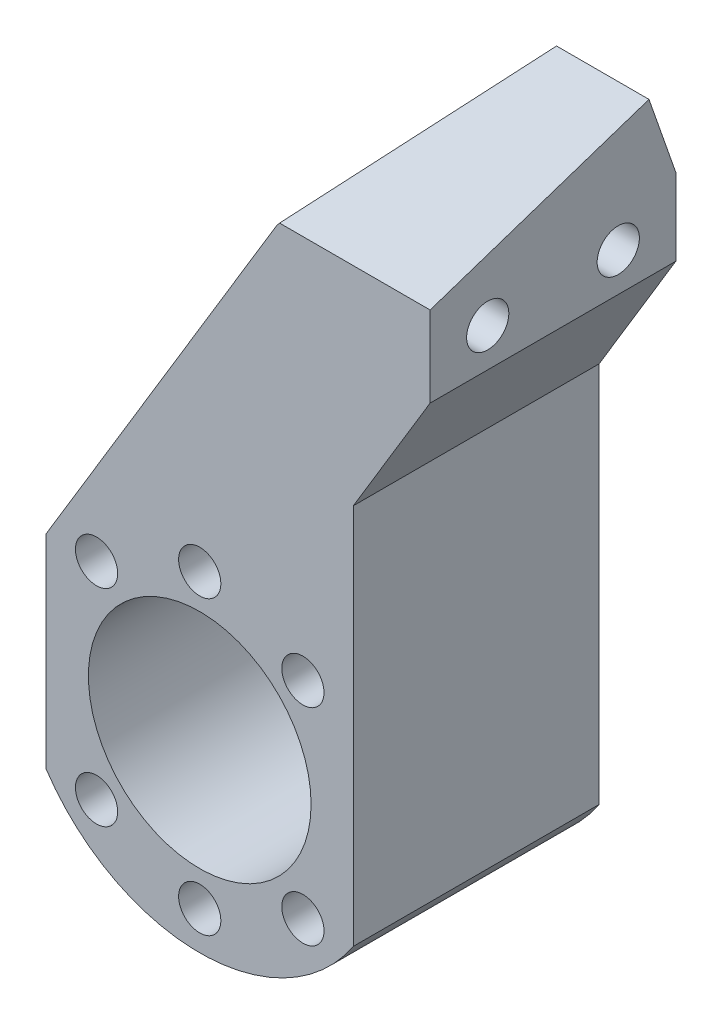
from build123d import *

# Parameters (mm, degrees)
ESQUISSE2_R             = 2.75
ESQUISSE2_R_2           = 14.5
BOSS_EXTRU_1_DEPTH      = 32
BOSS_EXTRU_4_DEPTH      = 32
ENL_V_MAT_EXTRU_3_REACH = 88.563
ESQUISSE10_R            = 2.75
BOSS_EXTRU_6_DEPTH      = 20
ENL_V_MAT_EXTRU_4_REACH = 87.165
ENL_V_MAT_EXTRU_5_REACH = 91.18
ESQUISSE13_R            = 6


with BuildPart() as part:
    # Esquisse2 → Boss.-Extru.1 (new body)
    with BuildSketch(Plane.XY):
        with BuildLine():
            Line((20, 13.266499161), (20, -13.266499161))
            ThreePointArc((20, -13.266499161), (0, -24), (-20, -13.266499161))
            Line((-20, -13.266499161), (-20, 13.266499161))
            ThreePointArc((-20, 13.266499161), (0, 24), (20, 13.266499161))
        make_face()
        with Locations((0, 19)):
            Circle(ESQUISSE2_R, mode=Mode.SUBTRACT)
        with Locations((-13.435028843, 13.435028843)):
            Circle(ESQUISSE2_R, mode=Mode.SUBTRACT)
        with Locations((13.435028843, 13.435028843)):
            Circle(ESQUISSE2_R, mode=Mode.SUBTRACT)
        with Locations((0, -19)):
            Circle(ESQUISSE2_R, mode=Mode.SUBTRACT)
        with Locations((13.435028843, -13.435028843)):
            Circle(ESQUISSE2_R, mode=Mode.SUBTRACT)
        with Locations((-13.435028843, -13.435028843)):
            Circle(ESQUISSE2_R, mode=Mode.SUBTRACT)
        Circle(ESQUISSE2_R_2, mode=Mode.SUBTRACT)
    extrude(amount=BOSS_EXTRU_1_DEPTH)

    # Esquisse7 → Boss.-Extru.4 (add)
    with BuildSketch(Plane(origin=(0, 0, 0), x_dir=(-1, 0, 0), z_dir=(0, 0, -1))):
        with BuildLine():
            Line((-10, 63.000996071), (20, 13.266499161))
            ThreePointArc((20, 13.266499161), (0, 24), (-20, 13.266499161))
            Line((-20, 13.266499161), (-20, 36.422830435))
            Line((-20, 36.422830435), (-30, 53.000996071))
            Line((-30, 53.000996071), (-30, 63.000996071))
            Line((-30, 63.000996071), (-10, 63.000996071))
        make_face()
    extrude(amount=-BOSS_EXTRU_4_DEPTH)

    # Enlèv. mat.-Extru.3: up to this plane
    enl_v_mat_extru_3_end = Plane(origin=(10, 63.000996071, 102.523188973), z_dir=(-0.8562805371039014, 0.5165110277400223, 0))
    # Esquisse10 → Enlèv. mat.-Extru.3 (cut, up to the surface)
    with BuildSketch(Plane(origin=(30, 0, 0), x_dir=(0, 0, -1), z_dir=(1, 0, 0)), mode=Mode.PRIVATE) as enl_v_mat_extru_3_sk1:
        with Locations((-24.5, 58.000996071)):
            Circle(ESQUISSE10_R)
    enl_v_mat_extru_3_tool1 = split(extrude(enl_v_mat_extru_3_sk1.sketch, amount=-ENL_V_MAT_EXTRU_3_REACH, mode=Mode.PRIVATE), bisect_by=enl_v_mat_extru_3_end, keep=Keep.BOTH, mode=Mode.PRIVATE)
    add(enl_v_mat_extru_3_tool1.solids().sort_by_distance((30, 58.000996, 24.5))[0], mode=Mode.SUBTRACT)
    # Esquisse10 → Enlèv. mat.-Extru.3 (cut, up to the surface)
    with BuildSketch(Plane(origin=(30, 0, 0), x_dir=(0, 0, -1), z_dir=(1, 0, 0)), mode=Mode.PRIVATE) as enl_v_mat_extru_3_sk2:
        with Locations((-7.5, 58.000996071)):
            Circle(ESQUISSE10_R)
    enl_v_mat_extru_3_tool2 = split(extrude(enl_v_mat_extru_3_sk2.sketch, amount=-ENL_V_MAT_EXTRU_3_REACH, mode=Mode.PRIVATE), bisect_by=enl_v_mat_extru_3_end, keep=Keep.BOTH, mode=Mode.PRIVATE)
    add(enl_v_mat_extru_3_tool2.solids().sort_by_distance((30, 58.000996, 7.5))[0], mode=Mode.SUBTRACT)

    # Esquisse11 → Boss.-Extru.6 (add)
    with BuildSketch(Plane(origin=(30, 0, 0), x_dir=(0, 0, -1), z_dir=(1, 0, 0))):
        Polygon((-32, 63.000996071), (0, 63.000996071), (-3.5, 73.000996071), (-32, 63.500996071), align=None)
    extrude(amount=-BOSS_EXTRU_6_DEPTH)

    # Esquisse12 → Enlèv. mat.-Extru.4 (cut, up to next)
    with BuildSketch(Plane(origin=(0, 0, 0), x_dir=(-1, 0, 0), z_dir=(0, 0, -1)), mode=Mode.PRIVATE) as enl_v_mat_extru_4_sk1:
        Polygon((-10, 63.000996071), (-17.962764916, 73.000996071), (-10, 73.000996071), align=None)
    enl_v_mat_extru_4_tool1 = extrude(enl_v_mat_extru_4_sk1.sketch, amount=-ENL_V_MAT_EXTRU_4_REACH, mode=Mode.PRIVATE) & part.part
    add(enl_v_mat_extru_4_tool1.solids().sort_by_distance((12.654255, 69.667663, 0))[0], mode=Mode.SUBTRACT)

    # Esquisse13 → Enlèv. mat.-Extru.5 (cut, up to next)
    with BuildSketch(Plane(origin=(20, 0, 0), x_dir=(0, 0, -1), z_dir=(1, 0, 0)), mode=Mode.PRIVATE) as enl_v_mat_extru_5_sk1:
        with Locations((-7.5, 58.000996071)):
            Circle(ESQUISSE13_R)
    enl_v_mat_extru_5_tool1 = extrude(enl_v_mat_extru_5_sk1.sketch, amount=-ENL_V_MAT_EXTRU_5_REACH, mode=Mode.PRIVATE) & part.part
    # Esquisse13 → Enlèv. mat.-Extru.5 (cut, up to next)
    with BuildSketch(Plane(origin=(20, 0, 0), x_dir=(0, 0, -1), z_dir=(1, 0, 0)), mode=Mode.PRIVATE) as enl_v_mat_extru_5_sk2:
        with Locations((-24.5, 58.000996071)):
            Circle(ESQUISSE13_R)
    enl_v_mat_extru_5_tool2 = extrude(enl_v_mat_extru_5_sk2.sketch, amount=-ENL_V_MAT_EXTRU_5_REACH, mode=Mode.PRIVATE) & part.part
    add(enl_v_mat_extru_5_tool1.solids().sort_by_distance((20, 58.000996, 7.5))[0], mode=Mode.SUBTRACT)
    add(enl_v_mat_extru_5_tool2.solids().sort_by_distance((20, 58.000996, 24.5))[0], mode=Mode.SUBTRACT)


solid = part.part
